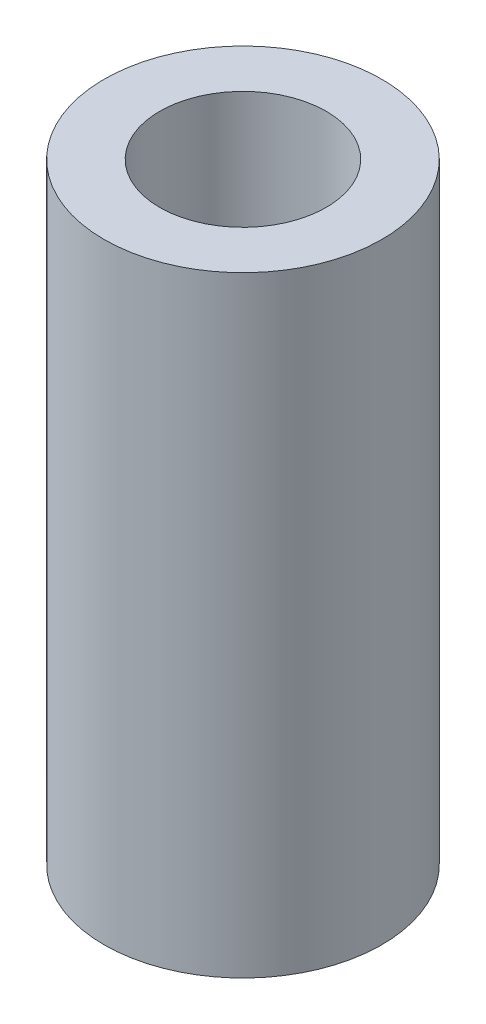
from build123d import *

# Parameters (mm, degrees)
SKETCH_1_R      = 2.5
SKETCH_1_R_2    = 1.5
EXTRUDE_1_DEPTH = 11


with BuildPart() as part:
    # Эскиз1 → Бобышка-Вытянуть1 (new body)
    with BuildSketch(Plane(origin=(0, 0, 0), x_dir=(1, 0, 0), z_dir=(0, 1, 0))):
        with Locations(Location((0, 0, 0), (0, 0, 270))):
            Circle(SKETCH_1_R)
        with Locations(Location((0, 0, 0), (0, 0, 270))):
            Circle(SKETCH_1_R_2, mode=Mode.SUBTRACT)
    extrude(amount=EXTRUDE_1_DEPTH)


solid = part.part
